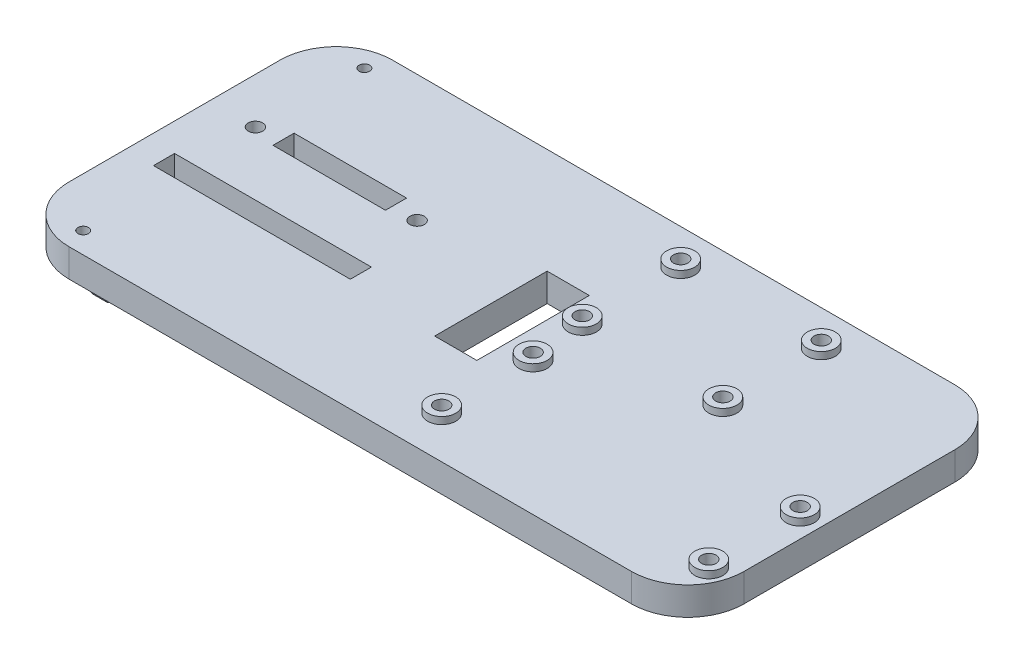
from build123d import *

# Parameters (mm, degrees)
SKETCH1_W             = 152.4
SKETCH1_H             = 73.025
BOSS_EXTRUDE1_DEPTH   = 6.35
SKETCH2_W             = 3.175
SKETCH2_H             = 3.175
BOSS_EXTRUDE2_DEPTH   = 9.652
SKETCH3_W             = 3.175
SKETCH3_H             = 3.175
BOSS_EXTRUDE3_DEPTH   = 3.048
M2_CLEARANCE_HOLE1_D  = 2.4
FILLET1_RADIUS        = 1.5875
FILLET1_LENGTH        = 3.175
FILLET2_R             = 1.5875
FILLET3_R             = 1.5875
FILLET4_RADIUS        = 1.5875
FILLET4_LENGTH        = 3.175
FILLET5_R             = 12.7
SKETCH9_W             = 44.45
SKETCH9_H             = 4.7625
SKETCH9_W_2           = 25.4
SKETCH9_W_3           = 9.525
SKETCH9_H_2           = 25.4
CUT_EXTRUDE1_DEPTH    = 86.998061956
F_4_CLEARANCE_HOLE1_D = 3.2639
SKETCH12_R            = 3.175
BOSS_EXTRUDE4_DEPTH   = 1.5875
F_4_CLEARANCE_HOLE3_D = 3.2639


with BuildPart() as part:
    # Sketch1 → Boss-Extrude1 (new body)
    with BuildSketch(Plane(origin=(0, 0, 0), x_dir=(1, 0, 0), z_dir=(0, 1, 0))):
        Rectangle(SKETCH1_W, SKETCH1_H)
    extrude(amount=BOSS_EXTRUDE1_DEPTH)

    # Sketch2 → Boss-Extrude2 (add)
    with BuildSketch(Plane.XZ):
        with Locations((-65.521407591, -26.442756121)):
            Rectangle(SKETCH2_W, SKETCH2_H)
    boss_extrude2 = extrude(amount=BOSS_EXTRUDE2_DEPTH)

    # Sketch3 → Boss-Extrude3 (add)
    with BuildSketch(Plane.XY.offset(-24.855256121)):
        with Locations((-65.521407591, -8.0645)):
            Rectangle(SKETCH3_W, SKETCH3_H)
    boss_extrude3 = extrude(amount=BOSS_EXTRUDE3_DEPTH)

    # Mirror1: Boss-Extrude2, Boss-Extrude3 across plane
    add(boss_extrude2.mirror(Plane.XY))
    add(boss_extrude3.mirror(Plane.XY))

    # M2 Clearance Hole1 (through all)
    with Locations(Plane(origin=(0, 0, 0), x_dir=(-1, 0, 0), z_dir=(0, -1, 0))):
        with Locations((65.0875, 31.75)):
            m2_clearance_hole1 = Hole(M2_CLEARANCE_HOLE1_D / 2)

    # Fillet1: full round fillet: the end face becomes a half cylinder, R = half its width
    fillet1_face = Plane((-65.521407591, -8.0645, 21.807256121), x_dir=(-1, 0, 0), z_dir=(0, 0, -1))  # on the end face: x along it, z out of the body
    fillet1_slab = fillet1_face.offset(-FILLET1_RADIUS / 2) * Box(FILLET1_LENGTH, 2 * FILLET1_RADIUS, FILLET1_RADIUS, mode=Mode.PRIVATE)  # the body's end, R deep
    fillet1_round = Plane((-65.521407591, -8.0645, 23.394756121), x_dir=(0, 0, -1), z_dir=(-1, 0, 0)) * Cylinder(FILLET1_RADIUS, FILLET1_LENGTH, mode=Mode.PRIVATE)  # its axis R under the face
    add(fillet1_slab - fillet1_round, mode=Mode.SUBTRACT)

    # Fillet2
    fillet2_edges = [part.edges().sort_by_distance(p)[0] for p in [
        (-65.521407591, -9.652, 28.030256121),
    ]]
    fillet(fillet2_edges, radius=FILLET2_R)

    # Mirror2: M2 Clearance Hole1 across plane
    add(m2_clearance_hole1.mirror(Plane.XY), mode=Mode.SUBTRACT)

    # Fillet3
    fillet3_edges = [part.edges().sort_by_distance(p)[0] for p in [
        (-65.521407591, -9.652, -28.030256121),
    ]]
    fillet(fillet3_edges, radius=FILLET3_R)

    # Fillet4: full round fillet: the end face becomes a half cylinder, R = half its width
    fillet4_face = Plane((-65.521407591, -8.0645, -21.807256121), x_dir=(-1, 0, 0), z_dir=(0, 0, 1))  # on the end face: x along it, z out of the body
    fillet4_slab = fillet4_face.offset(-FILLET4_RADIUS / 2) * Box(FILLET4_LENGTH, 2 * FILLET4_RADIUS, FILLET4_RADIUS, mode=Mode.PRIVATE)  # the body's end, R deep
    fillet4_round = Plane((-65.521407591, -8.0645, -23.394756121), x_dir=(0, 0, 1), z_dir=(-1, 0, 0)) * Cylinder(FILLET4_RADIUS, FILLET4_LENGTH, mode=Mode.PRIVATE)  # its axis R under the face
    add(fillet4_slab - fillet4_round, mode=Mode.SUBTRACT)

    # Fillet5
    fillet5_edges = [part.edges().sort_by_distance(p)[0] for p in [
        (76.2, 3.175, 36.5125),
        (-76.2, 3.175, 36.5125),
        (-76.2, 3.175, -36.5125),
        (76.2, 3.175, -36.5125),
    ]]
    fillet(fillet5_edges, radius=FILLET5_R)

    # Sketch9 → Cut-Extrude1 (cut, through all)
    with BuildSketch(Plane(origin=(0, 6.35, 0), x_dir=(1, 0, 0), z_dir=(0, 1, 0))):
        with Locations((-47.625, -8.73125)):
            Rectangle(SKETCH9_W, SKETCH9_H)
        with Locations((-47.625, 8.73125)):
            Rectangle(SKETCH9_W_2, SKETCH9_H)
        Rectangle(SKETCH9_W_3, SKETCH9_H_2)
    extrude(amount=-CUT_EXTRUDE1_DEPTH, mode=Mode.SUBTRACT)

    # #4 Clearance Hole1 (through all)
    with Locations(Plane(origin=(0, 6.35, 0), x_dir=(1, 0, 0), z_dir=(0, 1, 0))):
        with Locations((-65.88125, 7.9375), (-29.36875, 7.9375)):
            Hole(F_4_CLEARANCE_HOLE1_D / 2)

    # Sketch12 → Boss-Extrude4 (add)
    with BuildSketch(Plane(origin=(0, 6.35, 0), x_dir=(1, 0, 0), z_dir=(0, 1, 0))):
        with Locations(Location((9.525, 28.575, 0), (0, 0, 270))):
            Circle(SKETCH12_R)
        with Locations(Location((41.275, 28.575, 0), (0, 0, 270))):
            Circle(SKETCH12_R)
        with Locations(Location((41.275, 6.35, 0), (0, 0, 270))):
            Circle(SKETCH12_R)
        with Locations(Location((9.525, 6.35, 0), (0, 0, 270))):
            Circle(SKETCH12_R)
        with Locations(Location((11.1125, -6.35, 0), (0, 0, 270))):
            Circle(SKETCH12_R)
        with Locations(Location((11.1125, -26.9875, 0), (0, 0, 270))):
            Circle(SKETCH12_R)
        with Locations(Location((71.4375, -26.9875, 0), (0, 0, 270))):
            Circle(SKETCH12_R)
        with Locations(Location((71.4375, -6.35, 0), (0, 0, 270))):
            Circle(SKETCH12_R)
    extrude(amount=BOSS_EXTRUDE4_DEPTH)

    # #4 Clearance Hole3 (through all)
    with Locations(Plane(origin=(0, 7.9375, 0), x_dir=(1, 0, 0), z_dir=(0, 1, 0))):
        with Locations((9.525, 28.575), (41.275, 28.575), (41.275, 6.35), (9.525, 6.35), (11.1125, -6.35), (11.1125, -26.9875), (71.4375, -26.9875), (71.4375, -6.35)):
            Hole(F_4_CLEARANCE_HOLE3_D / 2)


solid = part.part
